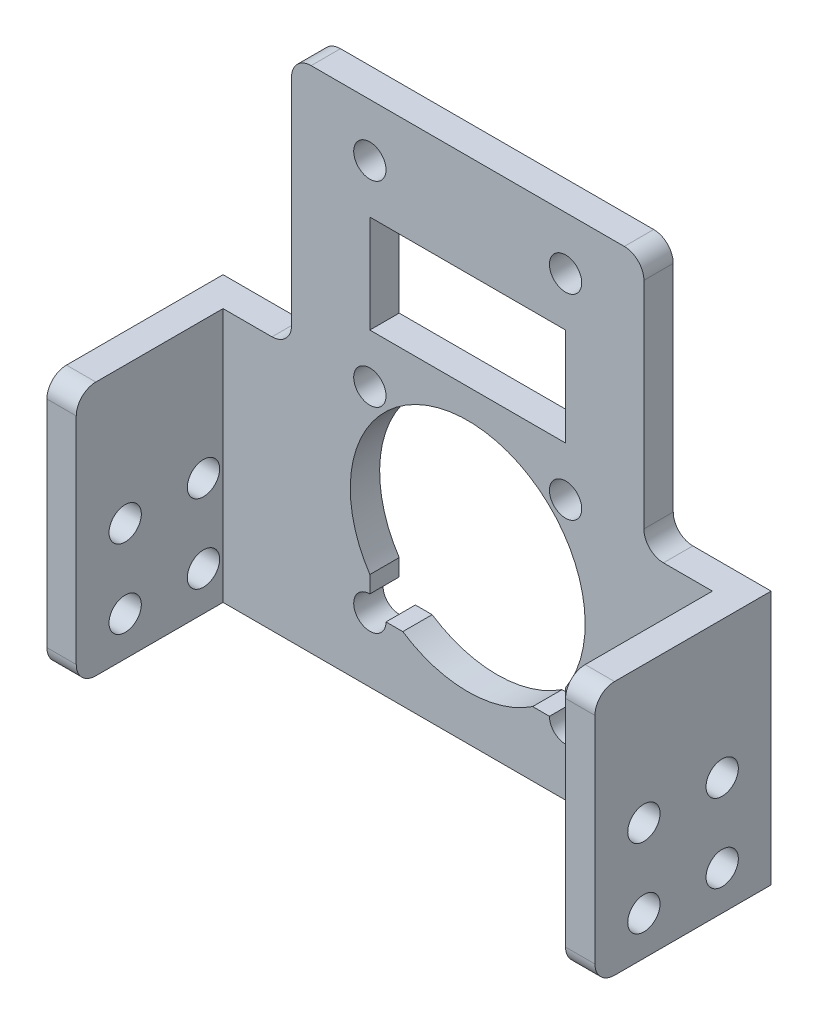
from build123d import *

# Parameters (mm, degrees)
SKETCH_1_W          = 3
SKETCH_1_H          = 26
EXTRUDE_4_DEPTH     = 3
SKETCH_2_W          = 3
SKETCH_2_H          = 26
EXTRUDE_5_DEPTH     = 15
CUT_EXTRUDE_2_DEPTH = 56
FILLET_2_R          = 2


with BuildPart() as part:
    # 草图1 → 凸台-拉伸4 (new body)
    with BuildSketch(Plane.XY):
        with BuildLine():
            Line((10, 26), (3, 26))
            Line((3, 26), (3, 0))
            Line((3, 0), (28, 0))
            Line((28, 0), (28, 4.6))
            ThreePointArc((28, 4.6), (24.535898385, 5.110874707), (21.366750419, 6.6))
            Line((21.366750419, 6.6), (19.65, 6.6))
            ThreePointArc((19.65, 6.6), (16.833273811, 5.433273811), (18, 8.25))
            Line((18, 8.25), (18, 9.966750419))
            ThreePointArc((18, 9.966750419), (16, 16.6), (18, 23.233249581))
            Line((18, 23.233249581), (18, 24.95))
            ThreePointArc((18, 24.95), (16.35, 26.6), (18, 28.25))
            Line((18, 28.25), (18, 31.6))
            Line((18, 31.6), (18, 41.6))
            Line((18, 41.6), (18, 44.95))
            ThreePointArc((18, 44.95), (16.833273811, 47.766726189), (19.65, 46.6))
            Line((19.65, 46.6), (28, 46.6))
            Line((28, 46.6), (28, 52))
            Line((28, 52), (10, 52))
            Line((10, 52), (10, 26))
        make_face()
        with BuildLine():
            Line((28, 4.6), (28, 0))
            Line((28, 0), (53, 0))
            Line((53, 0), (53, 26))
            Line((53, 26), (46, 26))
            Line((46, 26), (46, 52))
            Line((46, 52), (28, 52))
            Line((28, 52), (28, 46.6))
            Line((28, 46.6), (36.35, 46.6))
            ThreePointArc((36.35, 46.6), (38, 48.25), (39.65, 46.6))
            ThreePointArc((39.65, 46.6), (39.166726189, 45.433273811), (38, 44.95))
            Line((38, 44.95), (38, 41.6))
            Line((38, 41.6), (38, 31.6))
            Line((38, 31.6), (38, 28.25))
            ThreePointArc((38, 28.25), (39.166726189, 27.766726189), (39.65, 26.6))
            ThreePointArc((39.65, 26.6), (39.166726189, 25.433273811), (38, 24.95))
            Line((38, 24.95), (38, 23.233249581))
            ThreePointArc((38, 23.233249581), (39.489125293, 20.064101615), (40, 16.6))
            ThreePointArc((40, 16.6), (39.489125293, 13.135898385), (38, 9.966750419))
            Line((38, 9.966750419), (38, 8.25))
            ThreePointArc((38, 8.25), (39.166726189, 7.766726189), (39.65, 6.6))
            ThreePointArc((39.65, 6.6), (38, 4.95), (36.35, 6.6))
            Line((36.35, 6.6), (34.633249581, 6.6))
            ThreePointArc((34.633249581, 6.6), (31.464101615, 5.110874707), (28, 4.6))
        make_face()
        with Locations((54.5, 13)):
            Rectangle(SKETCH_1_W, SKETCH_1_H)
        with Locations((1.5, 13)):
            Rectangle(SKETCH_1_W, SKETCH_1_H)
        with BuildLine():
            ThreePointArc((18, 23.233249581), (22.325451338, 27.173528147), (28, 28.6))
            Line((28, 28.6), (28, 31.6))
            Line((28, 31.6), (23, 31.6))
            Line((23, 31.6), (18, 31.6))
            Line((18, 31.6), (18, 28.25))
            ThreePointArc((18, 28.25), (19.166726189, 27.766726189), (19.65, 26.6))
            ThreePointArc((19.65, 26.6), (19.166726189, 25.433273811), (18, 24.95))
            Line((18, 24.95), (18, 23.233249581))
        make_face()
        with BuildLine():
            Line((28, 31.6), (28, 28.6))
            ThreePointArc((28, 28.6), (33.674548662, 27.173528147), (38, 23.233249581))
            Line((38, 23.233249581), (38, 24.95))
            ThreePointArc((38, 24.95), (36.35, 26.6), (38, 28.25))
            Line((38, 28.25), (38, 31.6))
            Line((38, 31.6), (28, 31.6))
        make_face()
        with BuildLine():
            Line((28, 41.6), (28, 46.6))
            Line((28, 46.6), (19.65, 46.6))
            ThreePointArc((19.65, 46.6), (19.166726189, 45.433273811), (18, 44.95))
            Line((18, 44.95), (18, 41.6))
            Line((18, 41.6), (28, 41.6))
        make_face()
        with BuildLine():
            Line((36.35, 46.6), (28, 46.6))
            Line((28, 46.6), (28, 41.6))
            Line((28, 41.6), (33, 41.6))
            Line((33, 41.6), (38, 41.6))
            Line((38, 41.6), (38, 44.95))
            ThreePointArc((38, 44.95), (36.833273811, 45.433273811), (36.35, 46.6))
        make_face()
    extrude(amount=EXTRUDE_4_DEPTH)

    # 草图2 → 凸台-拉伸5 (add)
    with BuildSketch(Plane.XY.offset(3)):
        with Locations((1.5, 13)):
            Rectangle(SKETCH_2_W, SKETCH_2_H)
        with Locations((54.5, 13)):
            Rectangle(SKETCH_2_W, SKETCH_2_H)
    extrude(amount=EXTRUDE_5_DEPTH)

    # 草图5 → 切除-拉伸2 (cut)
    with BuildSketch(Plane.ZY):
        with BuildLine():
            ThreePointArc((5, 10.35), (6.166726189, 10.833273811), (6.65, 12))
            Line((6.65, 12), (5, 12))
            Line((5, 12), (5, 10.35))
        make_face()
        with BuildLine():
            Line((5, 12), (6.65, 12))
            ThreePointArc((6.65, 12), (3.833273811, 13.166726189), (5, 10.35))
            Line((5, 10.35), (5, 12))
        make_face()
        with BuildLine():
            ThreePointArc((11.35, 12), (11.833273811, 10.833273811), (13, 10.35))
            Line((13, 10.35), (13, 12))
            Line((13, 12), (11.35, 12))
        make_face()
        with BuildLine():
            Line((13, 12), (13, 10.35))
            ThreePointArc((13, 10.35), (14.166726189, 10.833273811), (14.65, 12))
            ThreePointArc((14.65, 12), (13, 13.65), (11.35, 12))
            Line((11.35, 12), (13, 12))
        make_face()
        with BuildLine():
            ThreePointArc((6.65, 4), (6.166726189, 5.166726189), (5, 5.65))
            Line((5, 5.65), (5, 4))
            Line((5, 4), (6.65, 4))
        make_face()
        with BuildLine():
            Line((5, 4), (5, 5.65))
            ThreePointArc((5, 5.65), (3.833273811, 2.833273811), (6.65, 4))
            Line((6.65, 4), (5, 4))
        make_face()
        with BuildLine():
            ThreePointArc((14.65, 4), (14.166726189, 5.166726189), (13, 5.65))
            Line((13, 5.65), (13, 4))
            Line((13, 4), (11.35, 4))
            ThreePointArc((11.35, 4), (13, 2.35), (14.65, 4))
        make_face()
        with BuildLine():
            Line((13, 4), (13, 5.65))
            ThreePointArc((13, 5.65), (11.833273811, 5.166726189), (11.35, 4))
            Line((11.35, 4), (13, 4))
        make_face()
    extrude(amount=-CUT_EXTRUDE_2_DEPTH, mode=Mode.SUBTRACT)

    # 圆角2
    fillet_2_edges = [part.edges().sort_by_distance(p)[0] for p in [
        (46, 26, 1.5),
        (10, 26, 1.5),
        (10, 52, 1.5),
        (46, 52, 1.5),
        (1.5, 26, 18),
        (1.5, 0, 18),
        (54.5, 26, 18),
        (54.5, 0, 18),
    ]]
    fillet(fillet_2_edges, radius=FILLET_2_R)


solid = part.part
